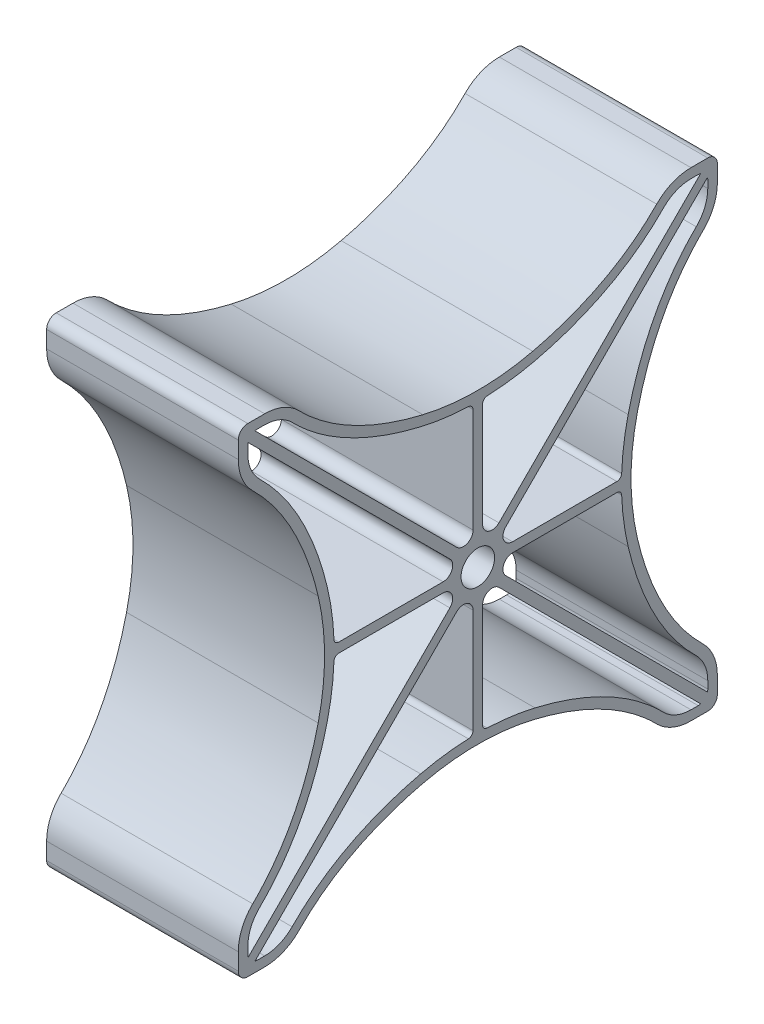
from build123d import *

# Parameters (mm, degrees)
BOSS_EXTRUDE1_DEPTH = 40
FILLET1_R           = 2
SKETCH3_R           = 3.5
BOSS_EXTRUDE2_DEPTH = 40
FILLET2_R           = 1


with BuildPart() as part:
    # Sketch1 → Boss-Extrude1 (new body)
    with BuildSketch(Plane(origin=(0, 0, 0), x_dir=(0, 0, -1), z_dir=(1, 0, 0))):
        with BuildLine():
            Line((100, 0), (100, -5.509803926))
            ThreePointArc((100, -5.509803926), (99.216139085, -9.390883719), (96.987443928, -12.663518161))
            add(Edge.make_bspline(
                [(96.987443928, -12.663518161), (94.284956793, -15.303192699), (88.725985213, -22.501160026), (85.001584131, -31.833431523), (83.50630434, -37.738521084), (83.320771704, -38.525392743)],
                knots=[0.087567714, 0.087567714, 0.087567714, 0.087567714, 0.336049895, 0.688961666, 0.74236025, 0.74236025, 0.74236025, 0.74236025], degree=3))
            ThreePointArc((83.320771704, -38.525392743), (81.98629737, -50), (83.320771704, -61.474607257))
            add(Edge.make_bspline(
                [(96.987443928, -87.336481839), (94.284956793, -84.696807301), (88.725985213, -77.498839974), (85.001584131, -68.166568477), (83.50630434, -62.261478916), (83.320771704, -61.474607257)],
                knots=[0.087567714, 0.087567714, 0.087567714, 0.087567714, 0.336049895, 0.688961666, 0.74236025, 0.74236025, 0.74236025, 0.74236025], degree=3))
            ThreePointArc((96.987443928, -87.336481839), (99.216139085, -90.609116281), (100, -94.490196074))
            Line((100, -94.490196074), (100, -100))
            Line((100, -100), (94.490196074, -100))
            ThreePointArc((94.490196074, -100), (90.609116281, -99.216139085), (87.336481839, -96.987443928))
            add(Edge.make_bspline(
                [(87.336481839, -96.987443928), (84.696807301, -94.284956793), (77.498839974, -88.725985213), (68.166568477, -85.001584131), (62.261478916, -83.50630434), (61.474607257, -83.320771704)],
                knots=[0.087567714, 0.087567714, 0.087567714, 0.087567714, 0.336049895, 0.688961666, 0.74236025, 0.74236025, 0.74236025, 0.74236025], degree=3))
            ThreePointArc((61.474607257, -83.320771704), (50, -81.98629737), (38.525392743, -83.320771704))
            add(Edge.make_bspline(
                [(12.663518161, -96.987443928), (15.303192699, -94.284956793), (22.501160026, -88.725985213), (31.833431523, -85.001584131), (37.738521084, -83.50630434), (38.525392743, -83.320771704)],
                knots=[0.087567714, 0.087567714, 0.087567714, 0.087567714, 0.336049895, 0.688961666, 0.74236025, 0.74236025, 0.74236025, 0.74236025], degree=3))
            ThreePointArc((12.663518161, -96.987443928), (9.390883719, -99.216139085), (5.509803926, -100))
            Line((5.509803926, -100), (0, -100))
            Line((0, -100), (0, -94.490196074))
            ThreePointArc((0, -94.490196074), (0.783860915, -90.609116281), (3.012556072, -87.336481839))
            add(Edge.make_bspline(
                [(3.012556072, -87.336481839), (5.715043207, -84.696807301), (11.274014787, -77.498839974), (14.998415869, -68.166568477), (16.49369566, -62.261478916), (16.679228296, -61.474607257)],
                knots=[0.087567714, 0.087567714, 0.087567714, 0.087567714, 0.336049895, 0.688961666, 0.74236025, 0.74236025, 0.74236025, 0.74236025], degree=3))
            ThreePointArc((16.679228296, -61.474607257), (18.01370263, -50), (16.679228296, -38.525392743))
            add(Edge.make_bspline(
                [(3.012556072, -12.663518161), (5.715043207, -15.303192699), (11.274014787, -22.501160026), (14.998415869, -31.833431523), (16.49369566, -37.738521084), (16.679228296, -38.525392743)],
                knots=[0.087567714, 0.087567714, 0.087567714, 0.087567714, 0.336049895, 0.688961666, 0.74236025, 0.74236025, 0.74236025, 0.74236025], degree=3))
            ThreePointArc((3.012556072, -12.663518161), (0.783860915, -9.390883719), (0, -5.509803926))
            Line((0, -5.509803926), (0, 0))
            Line((0, 0), (5.509803926, 0))
            ThreePointArc((5.509803926, 0), (9.390883719, -0.783860915), (12.663518161, -3.012556072))
            add(Edge.make_bspline(
                [(12.663518161, -3.012556072), (15.303192699, -5.715043207), (22.501160026, -11.274014787), (31.833431523, -14.998415869), (37.738521084, -16.49369566), (38.525392743, -16.679228296)],
                knots=[0.087567714, 0.087567714, 0.087567714, 0.087567714, 0.336049895, 0.688961666, 0.74236025, 0.74236025, 0.74236025, 0.74236025], degree=3))
            ThreePointArc((38.525392743, -16.679228296), (50, -18.01370263), (61.474607257, -16.679228296))
            add(Edge.make_bspline(
                [(87.336481839, -3.012556072), (84.696807301, -5.715043207), (77.498839974, -11.274014787), (68.166568477, -14.998415869), (62.261478916, -16.49369566), (61.474607257, -16.679228296)],
                knots=[0.087567714, 0.087567714, 0.087567714, 0.087567714, 0.336049895, 0.688961666, 0.74236025, 0.74236025, 0.74236025, 0.74236025], degree=3))
            ThreePointArc((87.336481839, -3.012556072), (90.609116281, -0.783860915), (94.490196074, 0))
            Line((94.490196074, 0), (100, 0))
        make_face()
        with BuildLine():
            Line((2, -2), (2, -5.509803926))
            ThreePointArc((2, -5.509803926), (2.627088732, -8.61466776), (4.410044858, -11.232775314))
            add(Edge.make_bspline(
                [(4.410044858, -11.232775314), (5.338828529, -12.139971717), (7.119384177, -14.045499285), (10.298925927, -18.104117855), (13.619253938, -23.620299694), (16.6302594, -30.724007948), (18.043201909, -35.595313625), (18.625849322, -38.066408453)],
                knots=[0.087567714, 0.087567714, 0.087567714, 0.087567714, 0.169416781, 0.251265848, 0.414963982, 0.578662116, 0.74236025, 0.74236025, 0.74236025, 0.74236025], degree=3))
            ThreePointArc((18.625849322, -38.066408453), (20.01370263, -50), (18.625849322, -61.933591547))
            add(Edge.make_bspline(
                [(18.625849322, -61.933591547), (18.043201909, -64.404686375), (16.6302594, -69.275992052), (13.619253938, -76.379700306), (10.298925927, -81.895882145), (7.119384178, -85.954500715), (5.338828529, -87.860028283), (4.410044858, -88.767224686)],
                knots=[0.087567714, 0.087567714, 0.087567714, 0.087567714, 0.251265848, 0.414963982, 0.578662116, 0.660511183, 0.74236025, 0.74236025, 0.74236025, 0.74236025], degree=3))
            ThreePointArc((4.410044858, -88.767224686), (2.627088732, -91.38533224), (2, -94.490196074))
            Line((2, -94.490196074), (2, -98))
            Line((2, -98), (5.509803926, -98))
            ThreePointArc((5.509803926, -98), (8.61466776, -97.372911268), (11.232775314, -95.589955142))
            add(Edge.make_bspline(
                [(11.232775314, -95.589955142), (12.139971717, -94.661171471), (14.045499285, -92.880615823), (18.104117855, -89.701074073), (23.620299694, -86.380746062), (30.724007948, -83.3697406), (35.595313625, -81.956798091), (38.066408453, -81.374150678)],
                knots=[0.087567714, 0.087567714, 0.087567714, 0.087567714, 0.169416781, 0.251265848, 0.414963982, 0.578662116, 0.74236025, 0.74236025, 0.74236025, 0.74236025], degree=3))
            ThreePointArc((38.066408453, -81.374150678), (50, -79.98629737), (61.933591547, -81.374150678))
            add(Edge.make_bspline(
                [(61.933591547, -81.374150678), (64.404686375, -81.956798091), (69.275992052, -83.3697406), (76.379700306, -86.380746062), (81.895882145, -89.701074073), (85.954500715, -92.880615823), (87.860028283, -94.661171471), (88.767224686, -95.589955142)],
                knots=[0.087567714, 0.087567714, 0.087567714, 0.087567714, 0.251265848, 0.414963982, 0.578662116, 0.660511183, 0.74236025, 0.74236025, 0.74236025, 0.74236025], degree=3))
            ThreePointArc((88.767224686, -95.589955142), (91.38533224, -97.372911268), (94.490196074, -98))
            Line((94.490196074, -98), (98, -98))
            Line((98, -98), (98, -94.490196074))
            ThreePointArc((98, -94.490196074), (97.372911268, -91.38533224), (95.589955142, -88.767224686))
            add(Edge.make_bspline(
                [(95.589955142, -88.767224686), (94.661171471, -87.860028283), (92.880615823, -85.954500715), (89.701074073, -81.895882145), (86.380746062, -76.379700306), (83.3697406, -69.275992052), (81.956798091, -64.404686375), (81.374150678, -61.933591547)],
                knots=[0.087567714, 0.087567714, 0.087567714, 0.087567714, 0.169416781, 0.251265848, 0.414963982, 0.578662116, 0.74236025, 0.74236025, 0.74236025, 0.74236025], degree=3))
            ThreePointArc((81.374150678, -61.933591547), (79.98629737, -50), (81.374150678, -38.066408453))
            add(Edge.make_bspline(
                [(81.374150678, -38.066408453), (81.956798091, -35.595313625), (83.3697406, -30.724007948), (86.380746062, -23.620299694), (89.701074073, -18.104117855), (92.880615823, -14.045499285), (94.661171471, -12.139971717), (95.589955142, -11.232775314)],
                knots=[0.087567714, 0.087567714, 0.087567714, 0.087567714, 0.251265848, 0.414963982, 0.578662116, 0.660511183, 0.74236025, 0.74236025, 0.74236025, 0.74236025], degree=3))
            ThreePointArc((95.589955142, -11.232775314), (97.372911268, -8.61466776), (98, -5.509803926))
            Line((98, -5.509803926), (98, -2))
            Line((98, -2), (94.490196074, -2))
            ThreePointArc((94.490196074, -2), (91.38533224, -2.627088732), (88.767224686, -4.410044858))
            add(Edge.make_bspline(
                [(88.767224686, -4.410044858), (87.860028283, -5.338828529), (85.954500715, -7.119384177), (81.895882145, -10.298925927), (76.379700306, -13.619253938), (69.275992052, -16.6302594), (64.404686375, -18.043201909), (61.933591547, -18.625849322)],
                knots=[0.087567714, 0.087567714, 0.087567714, 0.087567714, 0.169416781, 0.251265848, 0.414963982, 0.578662116, 0.74236025, 0.74236025, 0.74236025, 0.74236025], degree=3))
            ThreePointArc((61.933591547, -18.625849322), (50, -20.01370263), (38.066408453, -18.625849322))
            add(Edge.make_bspline(
                [(38.066408453, -18.625849322), (35.595313625, -18.043201909), (30.724007948, -16.6302594), (23.620299694, -13.619253938), (18.104117855, -10.298925927), (14.045499285, -7.119384177), (12.139971717, -5.338828529), (11.232775314, -4.410044858)],
                knots=[0.087567714, 0.087567714, 0.087567714, 0.087567714, 0.251265848, 0.414963982, 0.578662116, 0.660511183, 0.74236025, 0.74236025, 0.74236025, 0.74236025], degree=3))
            ThreePointArc((11.232775314, -4.410044858), (8.61466776, -2.627088732), (5.509803926, -2))
            Line((5.509803926, -2), (2, -2))
        make_face(mode=Mode.SUBTRACT)
    extrude(amount=BOSS_EXTRUDE1_DEPTH)

    # Fillet1
    fillet1_edges = [part.edges().sort_by_distance(p)[0] for p in [
        (20, 0, 0),
        (20, -2, -2),
        (20, -100, 0),
        (20, -98, -2),
        (20, 0, -100),
        (20, -2, -98),
        (20, -100, -100),
        (20, -98, -98),
    ]]
    fillet(fillet1_edges, radius=FILLET1_R)

    # Sketch3 → Boss-Extrude2 (add)
    with BuildSketch(Plane.ZY):
        with BuildLine():
            Line((-97.448946457, -98.86316002), (-54.414213562, -55.828427125))
            ThreePointArc((-54.414213562, -55.828427125), (-52.234633135, -55.394881622), (-51, -57.242640687))
            Line((-51, -57.242640687), (-51, -80.794692613))
            Line((-51, -80.794692613), (-49, -80.794692613))
            Line((-49, -80.794692613), (-49, -57.242640687))
            ThreePointArc((-49, -57.242640687), (-47.765366865, -55.394881622), (-45.585786438, -55.828427125))
            Line((-45.585786438, -55.828427125), (-2.436839732, -98.97737383))
            Line((-2.436839732, -98.97737383), (-1.02262617, -97.563160268))
            Line((-1.02262617, -97.563160268), (-44.171572875, -54.414213562))
            ThreePointArc((-44.171572875, -54.414213562), (-44.605118378, -52.234633135), (-42.757359313, -51))
            Line((-42.757359313, -51), (-18.99349413, -51))
            Line((-18.99349413, -51), (-18.99349413, -49))
            Line((-18.99349413, -49), (-42.757359313, -49))
            ThreePointArc((-42.757359313, -49), (-44.605118378, -47.765366865), (-44.171572875, -45.585786438))
            Line((-44.171572875, -45.585786438), (-1.02262617, -2.436839732))
            Line((-1.02262617, -2.436839732), (-2.436839732, -1.02262617))
            Line((-2.436839732, -1.02262617), (-45.585786438, -44.171572875))
            ThreePointArc((-45.585786438, -44.171572875), (-47.765366865, -44.605118378), (-49, -42.757359313))
            Line((-49, -42.757359313), (-49, -18.426005946))
            Line((-49, -18.426005946), (-51, -18.426005946))
            Line((-51, -18.426005946), (-51, -42.757359313))
            ThreePointArc((-51, -42.757359313), (-52.234633135, -44.605118378), (-54.414213562, -44.171572875))
            Line((-54.414213562, -44.171572875), (-97.563160268, -1.02262617))
            Line((-97.563160268, -1.02262617), (-99.118334148, -2.295879414))
            Line((-99.118334148, -2.295879414), (-55.828427125, -45.585786438))
            ThreePointArc((-55.828427125, -45.585786438), (-55.394881622, -47.765366865), (-57.242640687, -49))
            Line((-57.242640687, -49), (-80.942199568, -49))
            Line((-80.942199568, -49), (-80.942199568, -51))
            Line((-80.942199568, -51), (-57.242640687, -51))
            ThreePointArc((-57.242640687, -51), (-55.394881622, -52.234633135), (-55.828427125, -54.414213562))
            Line((-55.828427125, -54.414213562), (-98.86316002, -97.448946457))
            Line((-98.86316002, -97.448946457), (-97.448946457, -98.86316002))
        make_face()
        with Locations((-50, -50)):
            Circle(SKETCH3_R, mode=Mode.SUBTRACT)
    extrude(amount=-BOSS_EXTRUDE2_DEPTH)

    # Fillet2
    fillet2_edges = [part.edges().sort_by_distance(p)[0] for p in [
        (20, -79.995913643, -51),
        (20, -79.995913643, -49),
        (20, -51, -79.995913643),
        (20, -51, -20.004086357),
        (20, -49, -20.004086357),
        (20, -49, -79.995913643),
        (20, -20.004086357, -51),
        (20, -20.004086357, -49),
    ]]
    fillet(fillet2_edges, radius=FILLET2_R)


solid = part.part
